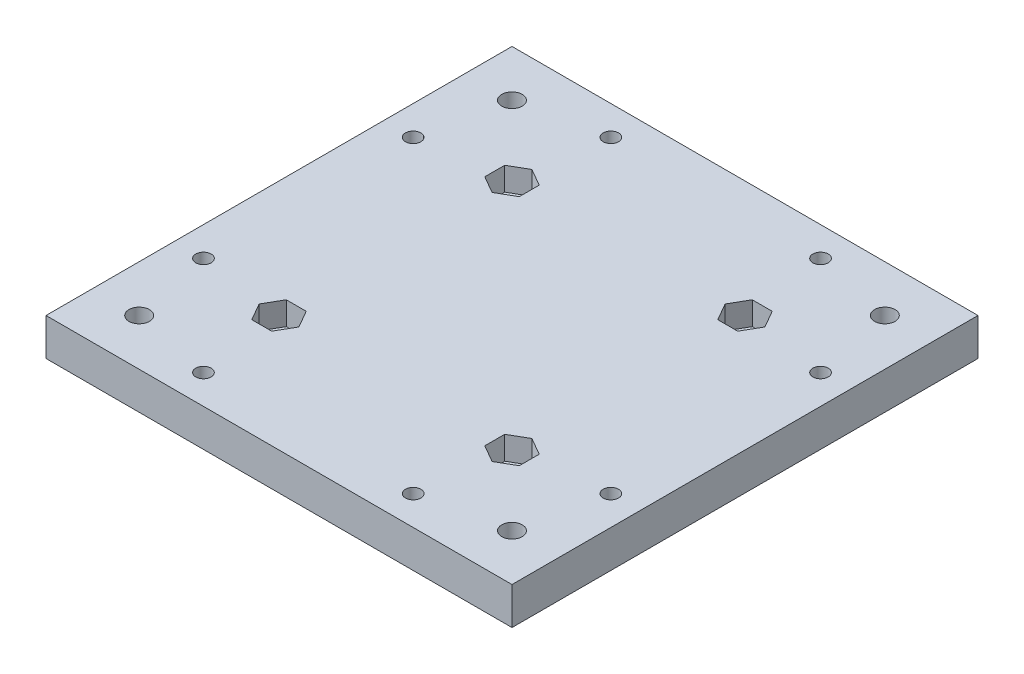
from build123d import *

# Parameters (mm, degrees)
SKETCH1_W           = 100
SKETCH1_H           = 100
SKETCH1_R           = 2.2
SKETCH1_R_2         = 1.65
BOSS_EXTRUDE1_DEPTH = 8
SKETCH1_3_R         = 2.15
BOSS_EXTRUDE2_DEPTH = 3
SKETCH1_4_R         = 2.2
CUT_EXTRUDE1_DEPTH  = 4
CHAMFER1_SIZE       = 2


with BuildPart() as part:
    # Sketch1 → Boss-Extrude1 (new body)
    with BuildSketch(Plane(origin=(0, 0, 0), x_dir=(1, 0, 0), z_dir=(0, 1, 0))):
        Rectangle(SKETCH1_W, SKETCH1_H)
        with Locations((40, 40)):
            Circle(SKETCH1_R, mode=Mode.SUBTRACT)
        with Locations((-22.5, -43.713203436)):
            Circle(SKETCH1_R_2, mode=Mode.SUBTRACT)
        Polygon((-22.863804004, -28.7), (-27.136195996, -28.7), (-29.272391992, -25), (-27.136195996, -21.3), (-22.863804004, -21.3), (-20.727608008, -25), align=None, mode=Mode.SUBTRACT)
        with Locations((-43.713203436, -22.5)):
            Circle(SKETCH1_R_2, mode=Mode.SUBTRACT)
        with Locations((22.5, -43.713203436)):
            Circle(SKETCH1_R_2, mode=Mode.SUBTRACT)
        Polygon((28.7, -22.863804004), (28.7, -27.136195996), (25, -29.272391992), (21.3, -27.136195996), (21.3, -22.863804004), (25, -20.727608008), align=None, mode=Mode.SUBTRACT)
        with Locations((43.713203436, -22.5)):
            Circle(SKETCH1_R_2, mode=Mode.SUBTRACT)
        with Locations((-43.713203436, 22.5)):
            Circle(SKETCH1_R_2, mode=Mode.SUBTRACT)
        Polygon((-28.7, 22.863804004), (-28.7, 27.136195996), (-25, 29.272391992), (-21.3, 27.136195996), (-21.3, 22.863804004), (-25, 20.727608008), align=None, mode=Mode.SUBTRACT)
        with Locations((-22.5, 43.713203436)):
            Circle(SKETCH1_R_2, mode=Mode.SUBTRACT)
        with Locations((43.713203436, 22.5)):
            Circle(SKETCH1_R_2, mode=Mode.SUBTRACT)
        with Locations((22.5, 43.713203436)):
            Circle(SKETCH1_R_2, mode=Mode.SUBTRACT)
        Polygon((22.863804004, 28.7), (27.136195996, 28.7), (29.272391992, 25), (27.136195996, 21.3), (22.863804004, 21.3), (20.727608008, 25), align=None, mode=Mode.SUBTRACT)
        with Locations((-40, -40)):
            Circle(SKETCH1_R, mode=Mode.SUBTRACT)
        with Locations((40, -40)):
            Circle(SKETCH1_R, mode=Mode.SUBTRACT)
        with Locations((-40, 40)):
            Circle(SKETCH1_R, mode=Mode.SUBTRACT)
    extrude(amount=BOSS_EXTRUDE1_DEPTH)

    # Sketch1<3> → Boss-Extrude2 (add)
    # profile 1 of 4: a face of its own
    with BuildSketch(Plane(origin=(0, 0, 0), x_dir=(1, 0, 0), z_dir=(0, 1, 0))):
        Polygon((25, -29.272391992), (28.7, -27.136195996), (28.7, -22.863804004), (25, -20.727608008), (21.3, -22.863804004), (21.3, -27.136195996), align=None)
        with Locations((25, -25)):
            Circle(SKETCH1_3_R, mode=Mode.SUBTRACT)
    # profile 2 of 4: a face of its own
    with BuildSketch(Plane(origin=(0, 0, 0), x_dir=(1, 0, 0), z_dir=(0, 1, 0))):
        Polygon((29.272391992, 25), (27.136195996, 28.7), (22.863804004, 28.7), (20.727608008, 25), (22.863804004, 21.3), (27.136195996, 21.3), align=None)
        with Locations((25, 25)):
            Circle(SKETCH1_3_R, mode=Mode.SUBTRACT)
    # profile 3 of 4: a face of its own
    with BuildSketch(Plane(origin=(0, 0, 0), x_dir=(1, 0, 0), z_dir=(0, 1, 0))):
        Polygon((-29.272391992, -25), (-27.136195996, -28.7), (-22.863804004, -28.7), (-20.727608008, -25), (-22.863804004, -21.3), (-27.136195996, -21.3), align=None)
        with Locations((-25, -25)):
            Circle(SKETCH1_3_R, mode=Mode.SUBTRACT)
    # profile 4 of 4: a face of its own
    with BuildSketch(Plane(origin=(0, 0, 0), x_dir=(1, 0, 0), z_dir=(0, 1, 0))):
        Polygon((-25, 29.272391992), (-28.7, 27.136195996), (-28.7, 22.863804004), (-25, 20.727608008), (-21.3, 22.863804004), (-21.3, 27.136195996), align=None)
        with Locations((-25, 25)):
            Circle(SKETCH1_3_R, mode=Mode.SUBTRACT)
    extrude(amount=BOSS_EXTRUDE2_DEPTH)

    # Sketch1<4> → Cut-Extrude1 (cut)
    # profile 1 of 4: a face of its own
    with BuildSketch(Plane(origin=(0, 0, 0), x_dir=(1, 0, 0), z_dir=(0, 1, 0))):
        Polygon((37.863804004, 36.3), (42.136195996, 36.3), (44.272391992, 40), (42.136195996, 43.7), (37.863804004, 43.7), (35.727608008, 40), align=None)
        with Locations((40, 40)):
            Circle(SKETCH1_4_R, mode=Mode.SUBTRACT)
    # profile 2 of 4: a face of its own
    with BuildSketch(Plane(origin=(0, 0, 0), x_dir=(1, 0, 0), z_dir=(0, 1, 0))):
        Polygon((36.3, -37.863804004), (36.3, -42.136195996), (40, -44.272391992), (43.7, -42.136195996), (43.7, -37.863804004), (40, -35.727608008), align=None)
        with Locations((40, -40)):
            Circle(SKETCH1_4_R, mode=Mode.SUBTRACT)
    # profile 3 of 4: a face of its own
    with BuildSketch(Plane(origin=(0, 0, 0), x_dir=(1, 0, 0), z_dir=(0, 1, 0))):
        Polygon((-37.863804004, -36.3), (-42.136195996, -36.3), (-44.272391992, -40), (-42.136195996, -43.7), (-37.863804004, -43.7), (-35.727608008, -40), align=None)
        with Locations((-40, -40)):
            Circle(SKETCH1_4_R, mode=Mode.SUBTRACT)
    # profile 4 of 4: a face of its own
    with BuildSketch(Plane(origin=(0, 0, 0), x_dir=(1, 0, 0), z_dir=(0, 1, 0))):
        Polygon((-36.3, 37.863804004), (-36.3, 42.136195996), (-40, 44.272391992), (-43.7, 42.136195996), (-43.7, 37.863804004), (-40, 35.727608008), align=None)
        with Locations((-40, 40)):
            Circle(SKETCH1_4_R, mode=Mode.SUBTRACT)
    extrude(amount=CUT_EXTRUDE1_DEPTH, mode=Mode.SUBTRACT)

    # Chamfer1
    chamfer1_edges = [part.edges().sort_by_distance(p)[0] for p in [
        (20.85, 0, -43.713203436),
        (42.063203436, 0, -22.5),
        (42.063203436, 0, 22.5),
        (20.85, 0, 43.713203436),
        (-24.15, 0, 43.713203436),
        (-45.363203436, 0, 22.5),
        (-24.15, 0, -43.713203436),
        (-45.363203436, 0, -22.5),
    ]]
    chamfer(chamfer1_edges, length=CHAMFER1_SIZE)


solid = part.part
